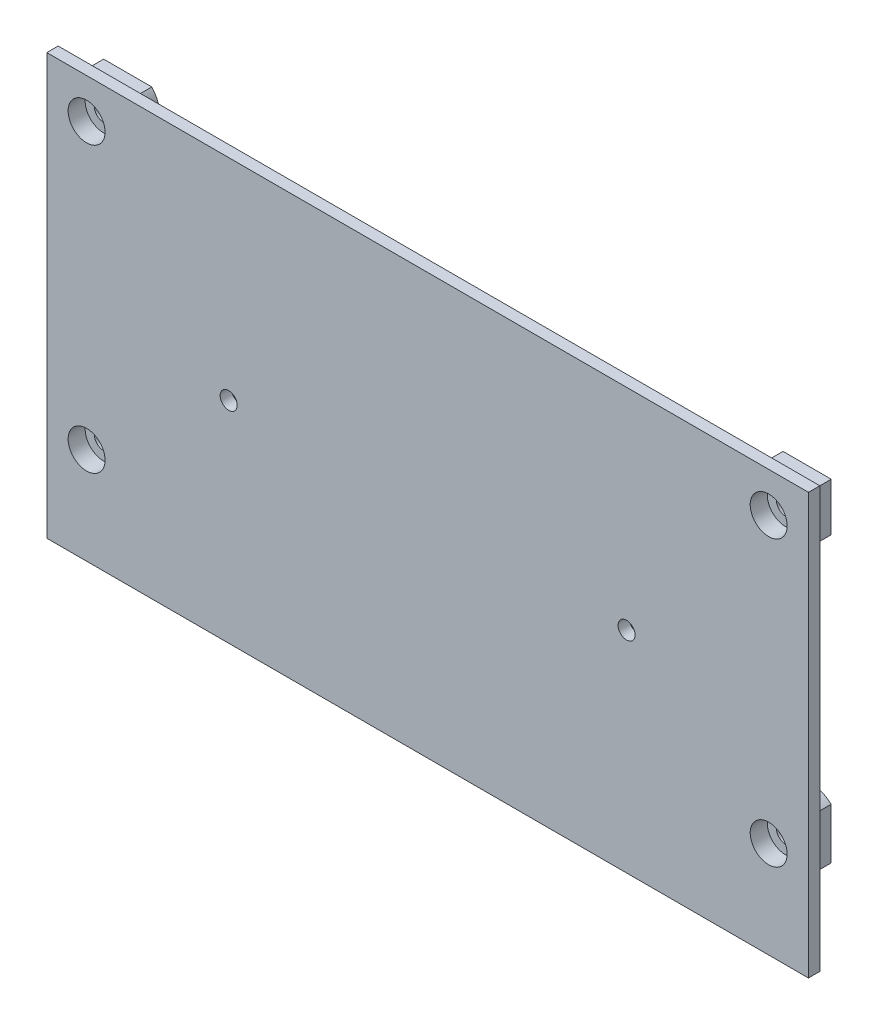
from build123d import *
from build123d.topology import SkipClean

# Parameters (mm, degrees)
ESBO_O1_W                       = 134
ESBO_O1_H                       = 74
ESBO_O1_R                       = 1.5
ESBO_O1_R_2                     = 1.65
RESSALTO_EXTRUS_O1_DEPTH        = 2
RESSALTO_EXTRUS_O2_START        = 5
ESBO_O2_R                       = 6
ESBO_O2_R_2                     = 1.5
ESBO_O2_R_3                     = 1.65
RESSALTO_EXTRUS_O2_DEPTH        = 5
ESBO_O3_R                       = 3.25
CORTE_EXTRUS_O1_DEPTH           = 3
CORTE_EXTRUS_O2_DEPTH           = 5
CORTE_EXTRUS_O2_DRAFT           = -12
CORTE_EXTRUS_O2_PROFILE_2_DEPTH = 5
CORTE_EXTRUS_O2_PROFILE_2_DRAFT = -12


with BuildPart() as part:
    # Esboço1 → Ressalto-extrusão1 (new body)
    with BuildSketch(Plane.XY):
        with Locations((67, -37)):
            Rectangle(ESBO_O1_W, ESBO_O1_H)
        with Locations((102, -37)):
            Circle(ESBO_O1_R, mode=Mode.SUBTRACT)
        with Locations((7, -7)):
            Circle(ESBO_O1_R_2, mode=Mode.SUBTRACT)
        with Locations((127, -7)):
            Circle(ESBO_O1_R_2, mode=Mode.SUBTRACT)
        with Locations((127, -57)):
            Circle(ESBO_O1_R_2, mode=Mode.SUBTRACT)
        with Locations((7, -57)):
            Circle(ESBO_O1_R_2, mode=Mode.SUBTRACT)
        with Locations((32, -37)):
            Circle(ESBO_O1_R, mode=Mode.SUBTRACT)
    extrude(amount=RESSALTO_EXTRUS_O1_DEPTH)

    # Esboço2 → Ressalto-extrusão2 (add)
    # profile 1 of 6: a face of its own
    with SkipClean():  # the faces are left unmerged after this step: merging them gives an invalid solid
        with BuildSketch(Plane(origin=(0, 0, 0), x_dir=(-1, 0, 0), z_dir=(0, 0, -1)).offset(RESSALTO_EXTRUS_O2_START)):
            with Locations((-102, -37)):
                Circle(ESBO_O2_R)
            with Locations((-102, -37)):
                Circle(ESBO_O2_R_2, mode=Mode.SUBTRACT)
        # profile 2 of 6: a face of its own
        with BuildSketch(Plane(origin=(0, 0, 0), x_dir=(-1, 0, 0), z_dir=(0, 0, -1)).offset(RESSALTO_EXTRUS_O2_START)):
            with Locations((-32, -37)):
                Circle(ESBO_O2_R)
            with Locations((-32, -37)):
                Circle(ESBO_O2_R_2, mode=Mode.SUBTRACT)
        # profile 3 of 6: a face of its own
        with BuildSketch(Plane(origin=(0, 0, 0), x_dir=(-1, 0, 0), z_dir=(0, 0, -1)).offset(RESSALTO_EXTRUS_O2_START)):
            with BuildLine():
                Line((-3, -61.472135955), (-3, -52.527864045))
                ThreePointArc((-3, -52.527864045), (-13, -57), (-3, -61.472135955))
            make_face()
            with Locations((-7, -57)):
                Circle(ESBO_O2_R_3, mode=Mode.SUBTRACT)
        # profile 4 of 6: a face of its own
        with BuildSketch(Plane(origin=(0, 0, 0), x_dir=(-1, 0, 0), z_dir=(0, 0, -1)).offset(RESSALTO_EXTRUS_O2_START)):
            with BuildLine():
                Line((-3, -3), (-11.472135955, -3))
                ThreePointArc((-11.472135955, -3), (-11.242640687, -11.242640687), (-3, -11.472135955))
                Line((-3, -11.472135955), (-3, -3))
            make_face()
            with Locations((-7, -7)):
                Circle(ESBO_O2_R_3, mode=Mode.SUBTRACT)
        # profile 5 of 6: a face of its own
        with BuildSketch(Plane(origin=(0, 0, 0), x_dir=(-1, 0, 0), z_dir=(0, 0, -1)).offset(RESSALTO_EXTRUS_O2_START)):
            with BuildLine():
                Line((-131, -61.472135955), (-131, -52.527864045))
                ThreePointArc((-131, -52.527864045), (-121, -57), (-131, -61.472135955))
            make_face()
            with Locations((-127, -57)):
                Circle(ESBO_O2_R_3, mode=Mode.SUBTRACT)
        # profile 6 of 6: a face of its own
        with BuildSketch(Plane(origin=(0, 0, 0), x_dir=(-1, 0, 0), z_dir=(0, 0, -1)).offset(RESSALTO_EXTRUS_O2_START)):
            with BuildLine():
                Line((-131, -11.472135955), (-131, -3))
                Line((-131, -3), (-122.527864045, -3))
                ThreePointArc((-122.527864045, -3), (-122.757359313, -11.242640687), (-131, -11.472135955))
            make_face()
            with Locations((-127, -7)):
                Circle(ESBO_O2_R_3, mode=Mode.SUBTRACT)
        extrude(amount=-RESSALTO_EXTRUS_O2_DEPTH)

    # Esboço3 → Corte-extrusão1 (cut)
    with SkipClean():  # the faces are left unmerged after this step: merging them gives an invalid solid
        with BuildSketch(Plane.XY.offset(2)):
            with Locations((7, -7)):
                Circle(ESBO_O3_R)
            with Locations((7, -57)):
                Circle(ESBO_O3_R)
            with Locations((127, -7)):
                Circle(ESBO_O3_R)
            with Locations((127, -57)):
                Circle(ESBO_O3_R)
        extrude(amount=-CORTE_EXTRUS_O1_DEPTH, mode=Mode.SUBTRACT)


with BuildPart() as corte_extrus_o2_tool:
    # Esboço4 → Corte-extrusão2 (with draft: the straight prism first)
    with BuildSketch(Plane(origin=(0, 0, -5), x_dir=(-1, 0, 0), z_dir=(0, 0, -1))):
        Polygon((-34.020725942, -40.5), (-29.979274058, -40.5), (-27.958548116, -37), (-29.979274058, -33.5), (-34.020725942, -33.5), (-36.041451884, -37), align=None)
    extrude(amount=-CORTE_EXTRUS_O2_DEPTH)
    # Corte-extrusão2: the draft: its side faces are tilted about the plane it starts from
    corte_extrus_o2_sides = [corte_extrus_o2_tool.faces().sort_by_distance(p)[0] for p in [
        (32, -40.5, -2.5),
        (28.968911087, -38.75, -2.5),
        (28.968911087, -35.25, -2.5),
        (32, -33.5, -2.5),
        (35.031088913, -35.25, -2.5),
        (35.031088913, -38.75, -2.5),
    ]]
    draft(corte_extrus_o2_sides, Plane(origin=(0, 0, -5), x_dir=(-1, 0, 0), z_dir=(0, 0, -1)), CORTE_EXTRUS_O2_DRAFT)


with BuildPart() as part_1:
    add(part.part)

    # Corte-extrusão2: cut by corte_extrus_o2_tool
    add(corte_extrus_o2_tool.part, mode=Mode.SUBTRACT)


with BuildPart() as corte_extrus_o2_profile_2_tool:
    # Esboço4 → Corte-extrusão2 profile 2 (with draft: the straight prism first)
    with BuildSketch(Plane(origin=(0, 0, -5), x_dir=(-1, 0, 0), z_dir=(0, 0, -1))):
        Polygon((-97.958548116, -37), (-99.979274058, -33.5), (-104.020725942, -33.5), (-106.041451884, -37), (-104.020725942, -40.5), (-99.979274058, -40.5), align=None)
    extrude(amount=-CORTE_EXTRUS_O2_PROFILE_2_DEPTH)
    # Corte-extrusão2 profile 2: the draft: its side faces are tilted about the plane it starts from
    corte_extrus_o2_profile_2_sides = [corte_extrus_o2_profile_2_tool.faces().sort_by_distance(p)[0] for p in [
        (98.968911087, -35.25, -2.5),
        (102, -33.5, -2.5),
        (105.031088913, -35.25, -2.5),
        (105.031088913, -38.75, -2.5),
        (102, -40.5, -2.5),
        (98.968911087, -38.75, -2.5),
    ]]
    draft(corte_extrus_o2_profile_2_sides, Plane(origin=(0, 0, -5), x_dir=(-1, 0, 0), z_dir=(0, 0, -1)), CORTE_EXTRUS_O2_PROFILE_2_DRAFT)


with BuildPart() as part_2:
    add(part_1.part)

    # Corte-extrusão2 profile 2: cut by corte_extrus_o2_profile_2_tool
    add(corte_extrus_o2_profile_2_tool.part, mode=Mode.SUBTRACT)


solid = part_2.part
